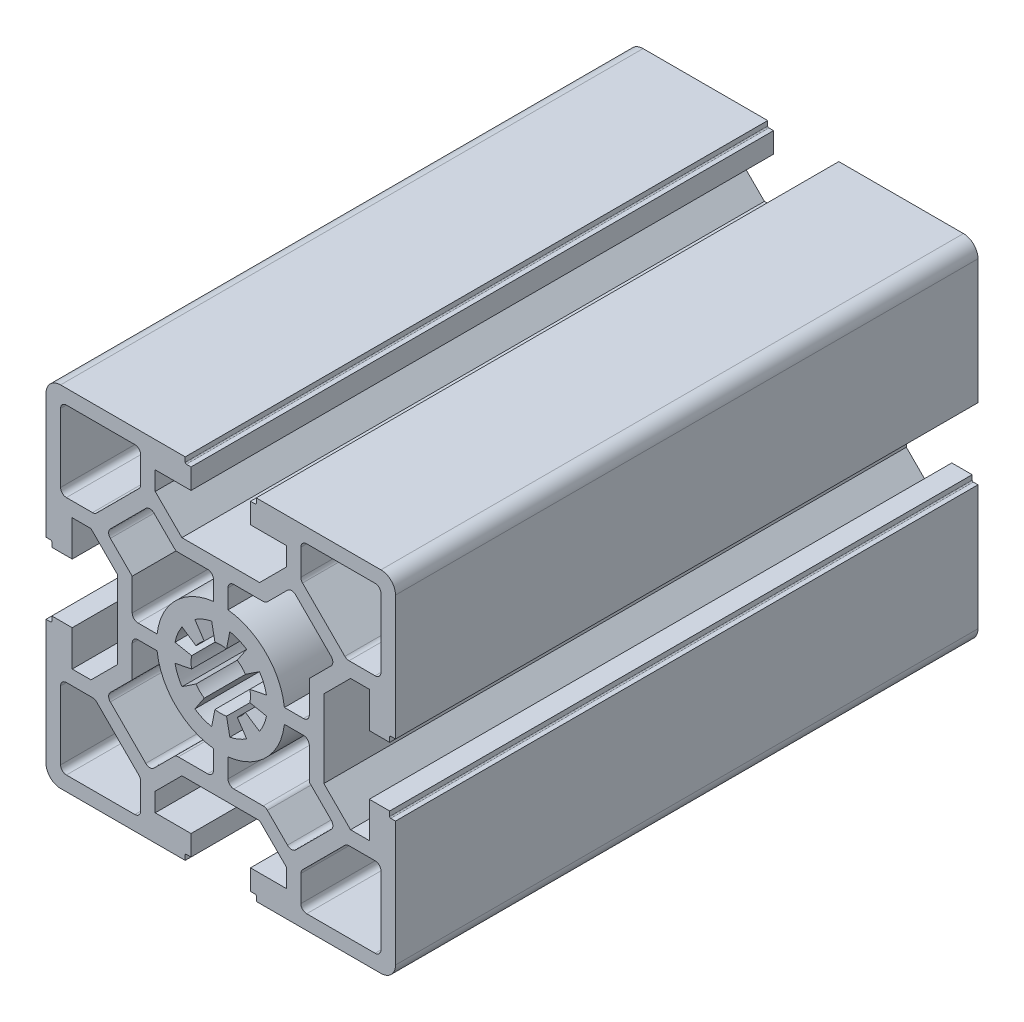
from build123d import *

# Parameters (mm, degrees)
EXTRUDE_1_DEPTH = 100


with BuildPart() as part:
    # 草图1 → 凸台-拉伸1 (new body)
    with BuildSketch(Plane.XY):
        with BuildLine():
            Line((-4.463172707, 29.848597475), (-25.863172707, 29.848597475))
            ThreePointArc((-25.863172707, 29.848597475), (-27.63093966, 29.116364428), (-28.363172707, 27.348597475))
            Line((-28.363172707, 27.348597475), (-28.363172707, 5.948597475))
            Line((-28.363172707, 5.948597475), (-27.563172707, 5.948597475))
            ThreePointArc((-27.563172707, 5.948597475), (-27.421751351, 5.890018832), (-27.363172707, 5.748597475))
            Line((-27.363172707, 5.748597475), (-27.363172707, 4.948597475))
            Line((-27.363172707, 4.948597475), (-23.863172707, 4.948597475))
            Line((-23.863172707, 4.948597475), (-23.863172707, 11.098597475))
            Line((-23.863172707, 11.098597475), (-20.644038493, 11.098597475))
            Line((-20.644038493, 11.098597475), (-16.063172707, 6.517731689))
            Line((-16.063172707, 6.517731689), (-16.063172707, -0.151402525))
            Line((-16.063172707, -0.151402525), (-16.063172707, -6.820536738))
            Line((-16.063172707, -6.820536738), (-20.644038493, -11.401402525))
            Line((-20.644038493, -11.401402525), (-23.863172707, -11.401402525))
            Line((-23.863172707, -11.401402525), (-23.863172707, -5.251402525))
            Line((-23.863172707, -5.251402525), (-27.363172707, -5.251402525))
            Line((-27.363172707, -5.251402525), (-27.363172707, -6.051402525))
            ThreePointArc((-27.363172707, -6.051402525), (-27.421751351, -6.192823881), (-27.563172707, -6.251402525))
            Line((-27.563172707, -6.251402525), (-28.363172707, -6.251402525))
            Line((-28.363172707, -6.251402525), (-28.363172707, -27.651402525))
            ThreePointArc((-28.363172707, -27.651402525), (-27.63093966, -29.419169478), (-25.863172707, -30.151402525))
            Line((-25.863172707, -30.151402525), (-4.463172707, -30.151402525))
            Line((-4.463172707, -30.151402525), (-4.463172707, -29.351402525))
            ThreePointArc((-4.463172707, -29.351402525), (-4.404594063, -29.209981168), (-4.263172707, -29.151402525))
            Line((-4.263172707, -29.151402525), (-3.463172707, -29.151402525))
            Line((-3.463172707, -29.151402525), (-3.463172707, -25.651402525))
            Line((-3.463172707, -25.651402525), (-9.613172707, -25.651402525))
            Line((-9.613172707, -25.651402525), (-9.613172707, -22.432268311))
            Line((-9.613172707, -22.432268311), (-5.03230692, -17.851402525))
            Line((-5.03230692, -17.851402525), (1.636827293, -17.851402525))
            Line((1.636827293, -17.851402525), (8.305961507, -17.851402525))
            Line((8.305961507, -17.851402525), (12.886827293, -22.432268311))
            Line((12.886827293, -22.432268311), (12.886827293, -25.651402525))
            Line((12.886827293, -25.651402525), (6.736827293, -25.651402525))
            Line((6.736827293, -25.651402525), (6.736827293, -29.151402525))
            Line((6.736827293, -29.151402525), (7.536827293, -29.151402525))
            ThreePointArc((7.536827293, -29.151402525), (7.678248649, -29.209981168), (7.736827293, -29.351402525))
            Line((7.736827293, -29.351402525), (7.736827293, -30.151402525))
            Line((7.736827293, -30.151402525), (29.136827293, -30.151402525))
            ThreePointArc((29.136827293, -30.151402525), (30.904594246, -29.419169478), (31.636827293, -27.651402525))
            Line((31.636827293, -27.651402525), (31.636827293, -6.251402525))
            Line((31.636827293, -6.251402525), (30.836827293, -6.251402525))
            ThreePointArc((30.836827293, -6.251402525), (30.695405937, -6.192823881), (30.636827293, -6.051402525))
            Line((30.636827293, -6.051402525), (30.636827293, -5.251402525))
            Line((30.636827293, -5.251402525), (27.136827293, -5.251402525))
            Line((27.136827293, -5.251402525), (27.136827293, -11.401402525))
            Line((27.136827293, -11.401402525), (23.91769308, -11.401402525))
            Line((23.91769308, -11.401402525), (19.336827293, -6.820536738))
            Line((19.336827293, -6.820536738), (19.336827293, -0.151402525))
            Line((19.336827293, -0.151402525), (19.336827293, 6.517731689))
            Line((19.336827293, 6.517731689), (23.91769308, 11.098597475))
            Line((23.91769308, 11.098597475), (27.136827293, 11.098597475))
            Line((27.136827293, 11.098597475), (27.136827293, 4.948597475))
            Line((27.136827293, 4.948597475), (30.636827293, 4.948597475))
            Line((30.636827293, 4.948597475), (30.636827293, 5.748597475))
            ThreePointArc((30.636827293, 5.748597475), (30.695405937, 5.890018832), (30.836827293, 5.948597475))
            Line((30.836827293, 5.948597475), (31.636827293, 5.948597475))
            Line((31.636827293, 5.948597475), (31.636827293, 27.348597475))
            ThreePointArc((31.636827293, 27.348597475), (30.904594246, 29.116364428), (29.136827293, 29.848597475))
            Line((29.136827293, 29.848597475), (7.736827293, 29.848597475))
            Line((7.736827293, 29.848597475), (7.736827293, 29.048597475))
            ThreePointArc((7.736827293, 29.048597475), (7.678248649, 28.907176119), (7.536827293, 28.848597475))
            Line((7.536827293, 28.848597475), (6.736827293, 28.848597475))
            Line((6.736827293, 28.848597475), (6.736827293, 25.348597475))
            Line((6.736827293, 25.348597475), (12.886827293, 25.348597475))
            Line((12.886827293, 25.348597475), (12.886827293, 22.129463262))
            Line((12.886827293, 22.129463262), (8.305961507, 17.548597475))
            Line((8.305961507, 17.548597475), (1.636827293, 17.548597475))
            Line((1.636827293, 17.548597475), (-5.03230692, 17.548597475))
            Line((-5.03230692, 17.548597475), (-9.613172707, 22.129463262))
            Line((-9.613172707, 22.129463262), (-9.613172707, 25.348597475))
            Line((-9.613172707, 25.348597475), (-3.463172707, 25.348597475))
            Line((-3.463172707, 25.348597475), (-3.463172707, 28.848597475))
            Line((-3.463172707, 28.848597475), (-4.263172707, 28.848597475))
            ThreePointArc((-4.263172707, 28.848597475), (-4.404594063, 28.907176119), (-4.463172707, 29.048597475))
            Line((-4.463172707, 29.048597475), (-4.463172707, 29.848597475))
        make_face()
        with BuildLine():
            Line((-24.863172707, 13.598597475), (-20.382725329, 13.598597475))
            ThreePointArc((-20.382725329, 13.598597475), (-20.000041896, 13.674717943), (-19.675618547, 13.891490694))
            Line((-19.675618547, 13.891490694), (-12.406065926, 21.161043316))
            ThreePointArc((-12.406065926, 21.161043316), (-12.189293174, 21.485466665), (-12.113172707, 21.868150097))
            Line((-12.113172707, 21.868150097), (-12.113172707, 26.348597475))
            ThreePointArc((-12.113172707, 26.348597475), (-12.406065926, 27.055704257), (-13.113172707, 27.348597475))
            Line((-13.113172707, 27.348597475), (-24.863172707, 27.348597475))
            ThreePointArc((-24.863172707, 27.348597475), (-25.570279488, 27.055704257), (-25.863172707, 26.348597475))
            Line((-25.863172707, 26.348597475), (-25.863172707, 14.598597475))
            ThreePointArc((-25.863172707, 14.598597475), (-25.570279488, 13.891490694), (-24.863172707, 13.598597475))
        make_face(mode=Mode.SUBTRACT)
        with BuildLine():
            Line((0.386827289, 10.777343971), (0.386827289, 14.048597474))
            ThreePointArc((0.386827289, 14.048597474), (0.093934076, 14.755704257), (-0.613172702, 15.048597482))
            Line((-0.613172702, 15.048597482), (-5.653627258, 15.048597482))
            ThreePointArc((-5.653627258, 15.048597482), (-6.036310691, 15.124717949), (-6.36073404, 15.341490701))
            Line((-6.36073404, 15.341490701), (-9.818302553, 18.799059214))
            ThreePointArc((-9.818302553, 18.799059214), (-10.525409334, 19.091952432), (-11.232516116, 18.799059213))
            Line((-11.232516116, 18.799059213), (-17.313634442, 12.717940887))
            ThreePointArc((-17.313634442, 12.717940887), (-17.606527661, 12.010834105), (-17.313634442, 11.303727324))
            Line((-17.313634442, 11.303727324), (-13.563172711, 7.553265594))
            Line((-13.563172711, 7.553265594), (-13.563172711, 2.098597474))
            ThreePointArc((-13.563172711, 2.098597474), (-13.270279493, 1.391490693), (-12.563172711, 1.098597474))
            Line((-12.563172711, 1.098597474), (-9.291919209, 1.098597474))
            ThreePointArc((-9.291919209, 1.098597474), (-6.141347304, 7.626772067), (0.386827289, 10.777343971))
        make_face(mode=Mode.SUBTRACT)
        with BuildLine():
            Line((-2.807734575, -6.803159424), (-1.1965809, -4.391897549))
            ThreePointArc((-1.1965809, -4.391897549), (-1.969417295, -3.75764711), (-2.603667734, -2.984810714))
            Line((-2.603667734, -2.984810714), (-5.01492961, -4.59596439))
            ThreePointArc((-5.01492961, -4.59596439), (-5.754208971, -3.212869985), (-6.209454955, -1.712125102))
            Line((-6.209454955, -1.712125102), (-3.365177641, -1.146363168))
            ThreePointArc((-3.365177641, -1.146363168), (-3.463172711, -0.151402526), (-3.365177641, 0.843558117))
            Line((-3.365177641, 0.843558117), (-6.209454955, 1.40932005))
            ThreePointArc((-6.209454955, 1.40932005), (-5.754208971, 2.910064933), (-5.01492961, 4.293159338))
            Line((-5.01492961, 4.293159338), (-2.603667734, 2.682005663))
            ThreePointArc((-2.603667734, 2.682005663), (-1.969417295, 3.454842058), (-1.1965809, 4.089092497))
            Line((-1.1965809, 4.089092497), (-2.807734575, 6.500354373))
            ThreePointArc((-2.807734575, 6.500354373), (-1.42464017, 7.239633734), (0.076104713, 7.694879717))
            Line((0.076104713, 7.694879717), (0.641866646, 4.850602404))
            ThreePointArc((0.641866646, 4.850602404), (1.636827289, 4.948597474), (2.631787931, 4.850602404))
            Line((2.631787931, 4.850602404), (3.197549865, 7.694879717))
            ThreePointArc((3.197549865, 7.694879717), (4.698294748, 7.239633734), (6.081389153, 6.500354373))
            Line((6.081389153, 6.500354373), (4.470235477, 4.089092497))
            ThreePointArc((4.470235477, 4.089092497), (5.243071873, 3.454842058), (5.877322311, 2.682005663))
            Line((5.877322311, 2.682005663), (8.288584187, 4.293159338))
            ThreePointArc((8.288584187, 4.293159338), (9.027863549, 2.910064933), (9.483109532, 1.40932005))
            Line((9.483109532, 1.40932005), (6.638832219, 0.843558117))
            ThreePointArc((6.638832219, 0.843558117), (6.736827289, -0.151402526), (6.638832219, -1.146363168))
            Line((6.638832219, -1.146363168), (9.483109532, -1.712125102))
            ThreePointArc((9.483109532, -1.712125102), (9.027863549, -3.212869985), (8.288584187, -4.59596439))
            Line((8.288584187, -4.59596439), (5.877322311, -2.984810714))
            ThreePointArc((5.877322311, -2.984810714), (5.243071873, -3.75764711), (4.470235477, -4.391897549))
            Line((4.470235477, -4.391897549), (6.081389153, -6.803159424))
            ThreePointArc((6.081389153, -6.803159424), (4.698294748, -7.542438786), (3.197549865, -7.997684769))
            Line((3.197549865, -7.997684769), (2.631787931, -5.153407456))
            ThreePointArc((2.631787931, -5.153407456), (1.636827289, -5.251402526), (0.641866646, -5.153407456))
            Line((0.641866646, -5.153407456), (0.076104713, -7.997684769))
            ThreePointArc((0.076104713, -7.997684769), (-1.42464017, -7.542438786), (-2.807734575, -6.803159424))
        make_face(mode=Mode.SUBTRACT)
        with BuildLine():
            Line((28.136827293, 13.598597475), (23.656379915, 13.598597475))
            ThreePointArc((23.656379915, 13.598597475), (23.273696482, 13.674717943), (22.949273134, 13.891490694))
            Line((22.949273134, 13.891490694), (15.679720512, 21.161043316))
            ThreePointArc((15.679720512, 21.161043316), (15.462947761, 21.485466665), (15.386827293, 21.868150097))
            Line((15.386827293, 21.868150097), (15.386827293, 26.348597475))
            ThreePointArc((15.386827293, 26.348597475), (15.679720512, 27.055704257), (16.386827293, 27.348597475))
            Line((16.386827293, 27.348597475), (28.136827293, 27.348597475))
            ThreePointArc((28.136827293, 27.348597475), (28.843934074, 27.055704257), (29.136827293, 26.348597475))
            Line((29.136827293, 26.348597475), (29.136827293, 14.598597475))
            ThreePointArc((29.136827293, 14.598597475), (28.843934074, 13.891490694), (28.136827293, 13.598597475))
        make_face(mode=Mode.SUBTRACT)
        with BuildLine():
            Line((2.886827289, 10.777343971), (2.886827289, 14.048597474))
            ThreePointArc((2.886827289, 14.048597474), (3.179720507, 14.755704255), (3.886827289, 15.048597474))
            Line((3.886827289, 15.048597474), (8.927281845, 15.048597474))
            ThreePointArc((8.927281845, 15.048597474), (9.309965278, 15.124717942), (9.634388627, 15.341490694))
            Line((9.634388627, 15.341490694), (13.09195714, 18.799059206))
            ThreePointArc((13.09195714, 18.799059206), (13.799063921, 19.091952425), (14.506170702, 18.799059206))
            Line((14.506170702, 18.799059206), (20.587289029, 12.717940879))
            ThreePointArc((20.587289029, 12.717940879), (20.880182239, 12.0108341), (20.587289019, 11.303727324))
            Line((20.587289019, 11.303727324), (16.836827289, 7.553265594))
            Line((16.836827289, 7.553265594), (16.836827289, 2.098597474))
            ThreePointArc((16.836827289, 2.098597474), (16.54393407, 1.391490693), (15.836827289, 1.098597474))
            Line((15.836827289, 1.098597474), (12.565573786, 1.098597474))
            ThreePointArc((12.565573786, 1.098597474), (9.415001882, 7.626772067), (2.886827289, 10.777343971))
        make_face(mode=Mode.SUBTRACT)
        with BuildLine():
            Line((-24.863172707, -13.901402525), (-20.382725329, -13.901402525))
            ThreePointArc((-20.382725329, -13.901402525), (-20.000041896, -13.977522992), (-19.675618547, -14.194295743))
            Line((-19.675618547, -14.194295743), (-12.406065926, -21.463848365))
            ThreePointArc((-12.406065926, -21.463848365), (-12.189293174, -21.788271714), (-12.113172707, -22.170955146))
            Line((-12.113172707, -22.170955146), (-12.113172707, -26.651402525))
            ThreePointArc((-12.113172707, -26.651402525), (-12.406065926, -27.358509306), (-13.113172707, -27.651402525))
            Line((-13.113172707, -27.651402525), (-24.863172707, -27.651402525))
            ThreePointArc((-24.863172707, -27.651402525), (-25.570279488, -27.358509306), (-25.863172707, -26.651402525))
            Line((-25.863172707, -26.651402525), (-25.863172707, -14.901402525))
            ThreePointArc((-25.863172707, -14.901402525), (-25.570279488, -14.194295743), (-24.863172707, -13.901402525))
        make_face(mode=Mode.SUBTRACT)
        with BuildLine():
            Line((0.386827297, -11.080149024), (0.386827297, -14.351402527))
            ThreePointArc((0.386827297, -14.351402527), (0.093934079, -15.058509308), (-0.613172703, -15.351402527))
            Line((-0.613172703, -15.351402527), (-5.653627259, -15.351402527))
            ThreePointArc((-5.653627259, -15.351402527), (-6.036310692, -15.427522994), (-6.360734041, -15.644295746))
            Line((-6.360734041, -15.644295746), (-9.818302553, -19.101864259))
            ThreePointArc((-9.818302553, -19.101864259), (-10.525409335, -19.394757478), (-11.232516116, -19.101864258))
            Line((-11.232516116, -19.101864258), (-17.313634443, -13.020745932))
            ThreePointArc((-17.313634443, -13.020745932), (-17.606527662, -12.313639151), (-17.313634443, -11.606532369))
            Line((-17.313634443, -11.606532369), (-13.563172712, -7.856070639))
            Line((-13.563172712, -7.856070639), (-13.563172712, -2.401402519))
            ThreePointArc((-13.563172712, -2.401402519), (-13.270279493, -1.694295738), (-12.563172712, -1.401402519))
            Line((-12.563172712, -1.401402519), (-9.291919209, -1.401402519))
            ThreePointArc((-9.291919209, -1.401402519), (-6.141347304, -7.92957712), (0.386827297, -11.080149024))
        make_face(mode=Mode.SUBTRACT)
        with BuildLine():
            Line((28.136827293, -13.901402525), (23.656379915, -13.901402525))
            ThreePointArc((23.656379915, -13.901402525), (23.273696482, -13.977522992), (22.949273134, -14.194295743))
            Line((22.949273134, -14.194295743), (15.679720512, -21.463848365))
            ThreePointArc((15.679720512, -21.463848365), (15.462947761, -21.788271714), (15.386827293, -22.170955146))
            Line((15.386827293, -22.170955146), (15.386827293, -26.651402525))
            ThreePointArc((15.386827293, -26.651402525), (15.679720512, -27.358509306), (16.386827293, -27.651402525))
            Line((16.386827293, -27.651402525), (28.136827293, -27.651402525))
            ThreePointArc((28.136827293, -27.651402525), (28.843934074, -27.358509306), (29.136827293, -26.651402525))
            Line((29.136827293, -26.651402525), (29.136827293, -14.901402525))
            ThreePointArc((29.136827293, -14.901402525), (28.843934074, -14.194295743), (28.136827293, -13.901402525))
        make_face(mode=Mode.SUBTRACT)
        with BuildLine():
            Line((2.886827289, -11.080149023), (2.886827289, -14.351402526))
            ThreePointArc((2.886827289, -14.351402526), (3.179720507, -15.058509307), (3.886827289, -15.351402526))
            Line((3.886827289, -15.351402526), (8.927281845, -15.351402526))
            ThreePointArc((8.927281845, -15.351402526), (9.309965278, -15.427522993), (9.634388627, -15.644295745))
            Line((9.634388627, -15.644295745), (13.09195714, -19.101864258))
            ThreePointArc((13.09195714, -19.101864258), (13.799063921, -19.394757477), (14.506170702, -19.101864257))
            Line((14.506170702, -19.101864257), (20.587289029, -13.020745931))
            ThreePointArc((20.587289029, -13.020745931), (20.880182239, -12.313639151), (20.587289019, -11.606532376))
            Line((20.587289019, -11.606532376), (16.836827289, -7.856070645))
            Line((16.836827289, -7.856070645), (16.836827289, -2.401402526))
            ThreePointArc((16.836827289, -2.401402526), (16.54393407, -1.694295745), (15.836827289, -1.401402526))
            Line((15.836827289, -1.401402526), (12.565573786, -1.401402526))
            ThreePointArc((12.565573786, -1.401402526), (9.415001882, -7.929577119), (2.886827289, -11.080149023))
        make_face(mode=Mode.SUBTRACT)
    extrude(amount=EXTRUDE_1_DEPTH)


solid = part.part
